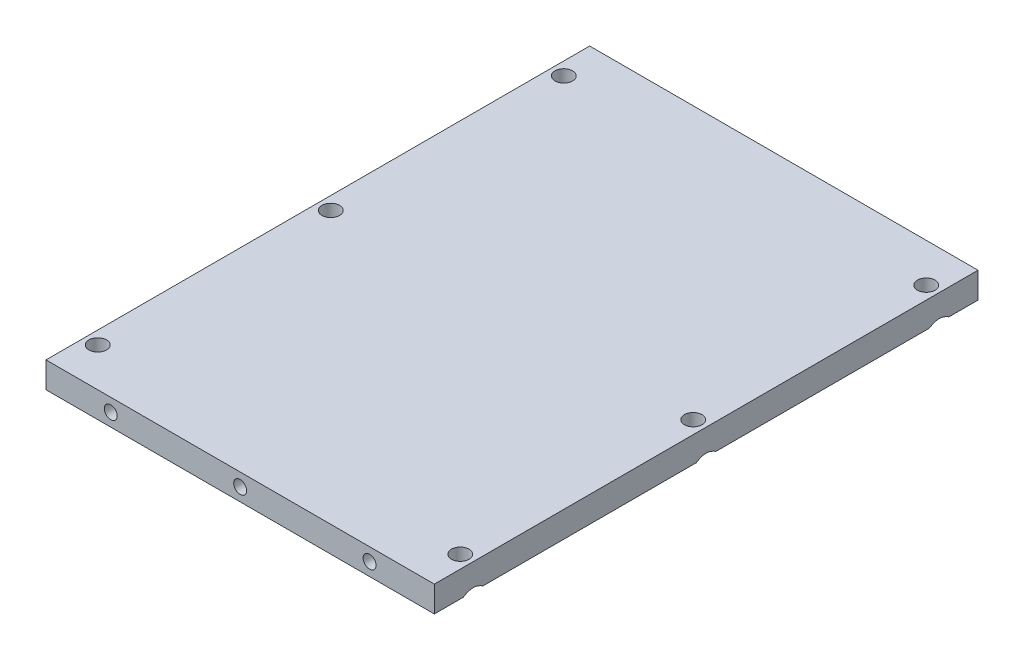
from build123d import *

# Parameters (mm, degrees)
SKETCH_1_W                   = 75
SKETCH_1_H                   = 105
EXTRUDE_432_DEPTH            = 5
HOLE_WIZARD_M3_D             = 2.5
HOLE_WIZARD_M3_DEPTH         = 10
HOLE_WIZARD_M3_TIP           = 0.751075774
HOLE_WIZARD_M3_2_D           = 1.6
HOLE_WIZARD_M3_2_DEPTH       = 10
HOLE_WIZARD_M3_2_CSINK_D     = 2.05
HOLE_WIZARD_M3_2_CSINK_ANGLE = 90
HOLE_WIZARD_M3_2_TIP         = 0.480688495
HOLE_WIZARD_M3_3_D           = 3.4
HOLE_WIZARD_M3_3_CSINK_D     = 6.3
HOLE_WIZARD_M3_3_CSINK_ANGLE = 90


with BuildPart() as part:
    # Эскиз1 → Extrude 432 (new body)
    with BuildSketch(Plane(origin=(0, 0, 0), x_dir=(1, 0, 0), z_dir=(0, 1, 0))):
        with Locations((0, 31.5)):
            Rectangle(SKETCH_1_W, SKETCH_1_H)
    extrude(amount=EXTRUDE_432_DEPTH)

    # Hole Wizard M3
    with Locations(Plane.XY.offset(21)):
        with Locations((-25, 2.5), (0, 2.5), (25, 2.5)):
            Hole(HOLE_WIZARD_M3_D / 2, depth=HOLE_WIZARD_M3_DEPTH)
            with Locations((0, 0, -(HOLE_WIZARD_M3_DEPTH + HOLE_WIZARD_M3_TIP / 2))):  # 118° drill point
                Cone(0, HOLE_WIZARD_M3_D / 2, HOLE_WIZARD_M3_TIP, mode=Mode.SUBTRACT)

    # Hole Wizard M3 2
    with Locations(Plane(origin=(0, 0, -84), x_dir=(-1, 0, 0), z_dir=(0, 0, -1))):
        with Locations((-25, 2.5), (0, 2.5), (25, 2.5)):
            CounterSinkHole(HOLE_WIZARD_M3_2_D / 2, HOLE_WIZARD_M3_2_CSINK_D / 2, depth=HOLE_WIZARD_M3_2_DEPTH, counter_sink_angle=HOLE_WIZARD_M3_2_CSINK_ANGLE)
            with Locations((0, 0, -(HOLE_WIZARD_M3_2_DEPTH + HOLE_WIZARD_M3_2_TIP / 2))):  # 118° drill point
                Cone(0, HOLE_WIZARD_M3_2_D / 2, HOLE_WIZARD_M3_2_TIP, mode=Mode.SUBTRACT)

    # Hole Wizard M3 3 (through all)
    with Locations(Plane.XZ):
        with Locations((-35, -31.5), (35, -31.5), (35, -76.5), (35, 13.5), (-35, 13.5), (-35, -76.5)):
            CounterSinkHole(HOLE_WIZARD_M3_3_D / 2, HOLE_WIZARD_M3_3_CSINK_D / 2, counter_sink_angle=HOLE_WIZARD_M3_3_CSINK_ANGLE)


solid = part.part
